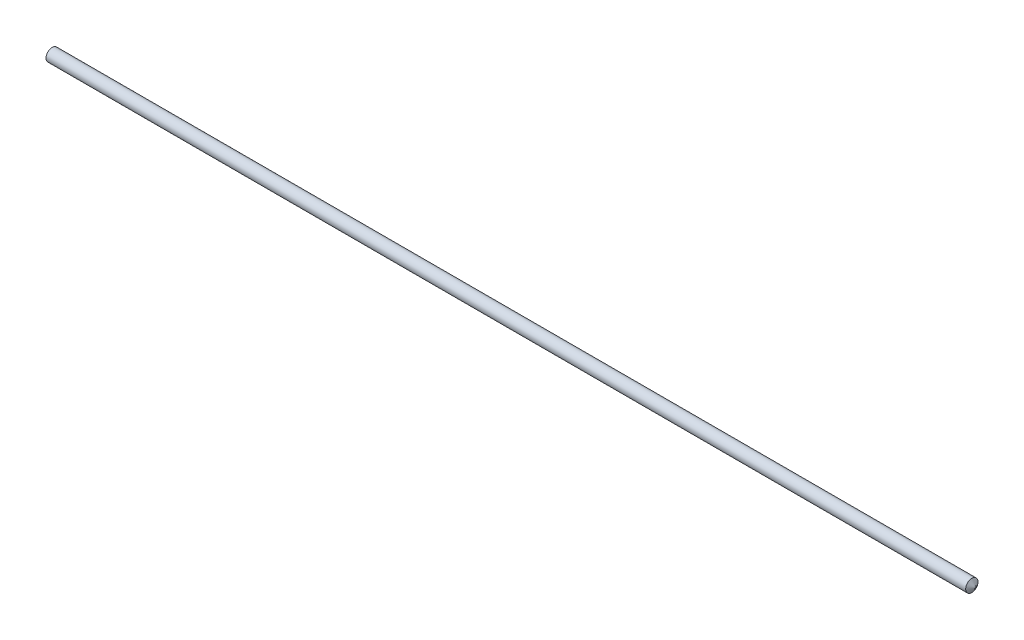
from build123d import *


with BuildPart() as part:
    # Sketch15 → Revolve1 (revolve)
    with BuildSketch(Plane(origin=(0, 0, 0), x_dir=(1, 0, 0), z_dir=(0, 1, 0)), mode=Mode.PRIVATE) as revolve1_sk:
        Polygon((0, 0), (0.600860619, 1), (149.399139381, 1), (150, 0), align=None)
    revolve(revolve1_sk.sketch.rotate(Axis((0, 0, 0), (1, 0, 0)), 180), axis=Axis((0, 0, 0), (1, 0, 0)))


solid = part.part
